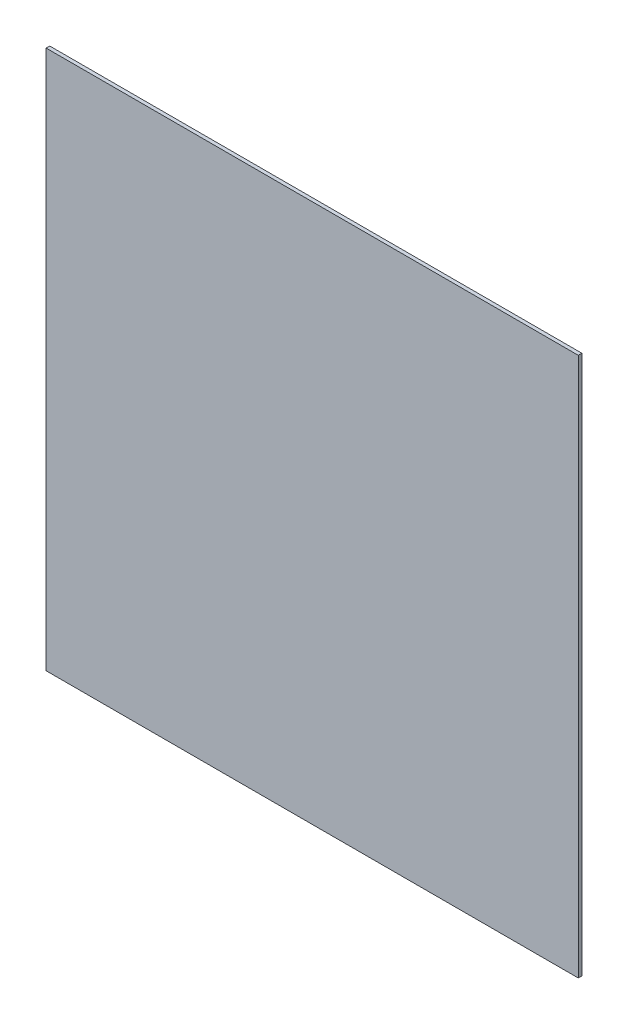
from build123d import *

# Parameters (mm, degrees)
SKETCH1_W           = 444
SKETCH1_H           = 450
BOSS_EXTRUDE1_DEPTH = 3


with BuildPart() as part:
    # Sketch1 → Boss-Extrude1 (new body)
    with BuildSketch(Plane.XY):
        with Locations((222, 225)):
            Rectangle(SKETCH1_W, SKETCH1_H)
    extrude(amount=BOSS_EXTRUDE1_DEPTH)


solid = part.part
